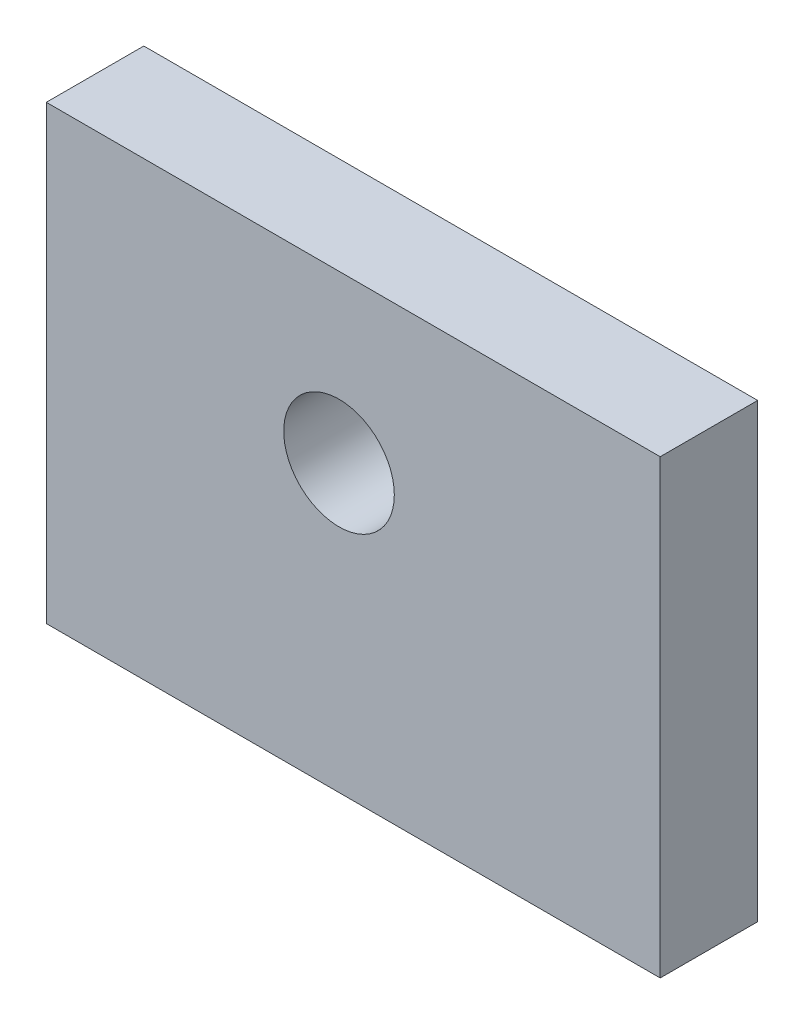
from build123d import *

# Parameters (mm, degrees)
SKETCH1_W           = 157.427258437
SKETCH1_H           = 115.774728642
BOSS_EXTRUDE1_DEPTH = 25
SKETCH2_R           = 14.180253709
CUT_EXTRUDE1_DEPTH  = 121.52618336


with BuildPart() as part:
    # Sketch1 → Boss-Extrude1 (new body)
    with BuildSketch(Plane.XY):
        with Locations((4.361409685, -25.779228693)):
            Rectangle(SKETCH1_W, SKETCH1_H)
    extrude(amount=-BOSS_EXTRUDE1_DEPTH)

    # Sketch2 → Cut-Extrude1 (cut, through all)
    with BuildSketch(Plane.XY):
        with Locations((0.709746473, -10.476281952)):
            Circle(SKETCH2_R)
    extrude(amount=-CUT_EXTRUDE1_DEPTH, mode=Mode.SUBTRACT)


solid = part.part
